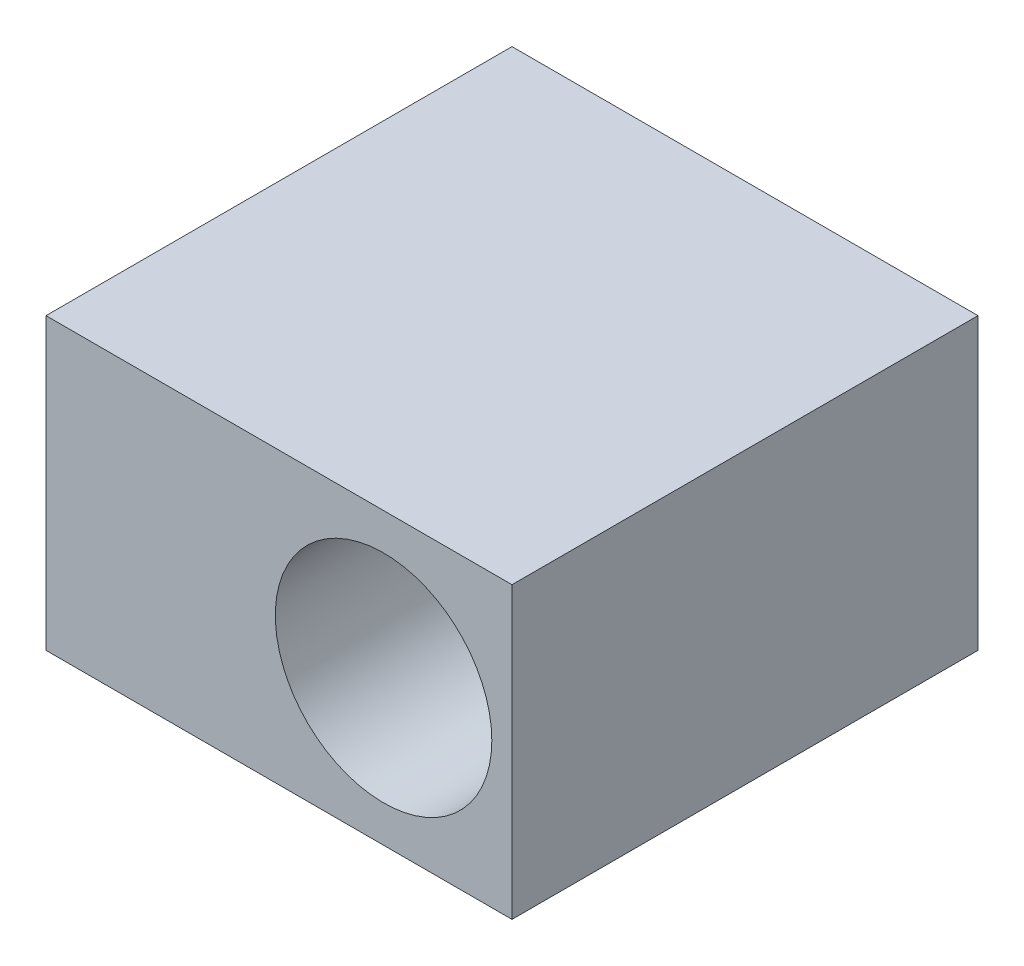
from build123d import *

# Parameters (mm, degrees)
SKETCH1_W           = 12.7
SKETCH1_H           = 12.7
BOSS_EXTRUDE1_DEPTH = 7.9
SKETCH2_R           = 2.95
CUT_EXTRUDE1_DEPTH  = 17.248769184
SKETCH3_R           = 3.65
BOSS_EXTRUDE2_DEPTH = 3.1
CHAMFER1_SIZE       = 1.8
CHAMFER1_SIZE2      = 2.995703068
SKETCH4_R           = 1.05
CUT_EXTRUDE2_DEPTH  = 4


with BuildPart() as part:
    # Sketch1 → Boss-Extrude1 (new body)
    with BuildSketch(Plane(origin=(0, 0, 0), x_dir=(1, 0, 0), z_dir=(0, 1, 0))):
        Rectangle(SKETCH1_W, SKETCH1_H)
    extrude(amount=BOSS_EXTRUDE1_DEPTH)

    # Sketch2 → Cut-Extrude1 (cut, through all)
    with BuildSketch(Plane.XY.offset(6.35)):
        with Locations((2.85, 3.95)):
            Circle(SKETCH2_R)
    extrude(amount=-CUT_EXTRUDE1_DEPTH, mode=Mode.SUBTRACT)

    # Sketch3 → Boss-Extrude2 (add)
    with BuildSketch(Plane.XZ):
        with Locations(Location((-2.65, 0, 0), (0, 0, 270))):
            Circle(SKETCH3_R)
    extrude(amount=BOSS_EXTRUDE2_DEPTH)

    # Chamfer1
    chamfer1_edges = [part.edges().sort_by_distance(p)[0] for p in [
        (-2.65, -3.1, 3.65),
    ]]
    chamfer1_side = [part.faces().sort_by_distance(p)[0] for p in [
        (-2.65, -1.55, 3.65),
    ]]
    chamfer(chamfer1_edges, length=CHAMFER1_SIZE, length2=CHAMFER1_SIZE2, reference=chamfer1_side[0])

    # Sketch4 → Cut-Extrude2 (cut)
    with BuildSketch(Plane.ZY.offset(6.35)):
        with Locations((-5.225, 3.95)):
            Circle(SKETCH4_R)
    extrude(amount=-CUT_EXTRUDE2_DEPTH, mode=Mode.SUBTRACT)


solid = part.part
